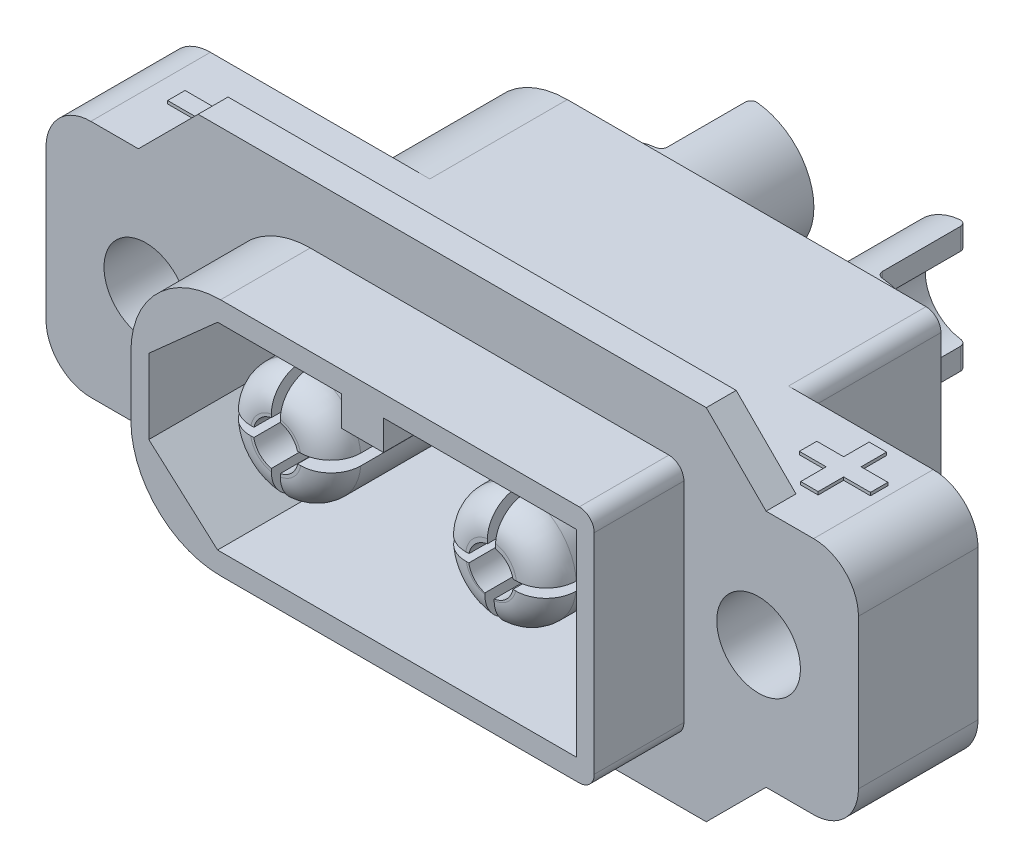
from build123d import *

# Parameters (mm, degrees)
BOSS_EXTRUDE1_DEPTH       = 3
BOSS_EXTRUDE1_DEPTH_BACK  = 8.6
SKETCH1_W                 = 15.5
SKETCH1_H                 = 8
FILLET1_R                 = 3
FILLET2_R                 = 0.5
SKETCH2_W                 = 27.18
SKETCH2_H                 = 8
BOSS_EXTRUDE2_DEPTH       = 4
FILLET3_R                 = 1.5
CUT_EXTRUDE1_DEPTH        = 1
BOSS_EXTRUDE3_DEPTH       = 1
SKETCH5_R                 = 1.4
CUT_EXTRUDE2_DEPTH        = 18.165316775
CUT_EXTRUDE3_DEPTH        = 2
CUT_EXTRUDE4_DEPTH        = 8.8
SKETCH8_R                 = 2.1
BOSS_EXTRUDE4_DEPTH       = 6
F_2_5MM_DOWEL_HOLE1_D     = 2.75
F_2_5MM_DOWEL_HOLE1_DEPTH = 6
F_2_5MM_DOWEL_HOLE1_TIP   = 0.826183351
SKETCH11_W                = 3.440433193
SKETCH11_H                = 4.792031948
SKETCH11_W_2              = 3.391284148
SKETCH11_H_2              = 4.542096385
CUT_EXTRUDE5_DEPTH        = 4.4
FILLET4_R                 = 0.2
SKETCH12_R                = 1.85
BOSS_EXTRUDE5_DEPTH       = 8.1
FILLET5_R                 = 1
CUT_EXTRUDE6_REACH        = 23.76
SKETCH15_W                = 1.211538462
SKETCH15_H                = 0.583333334
BOSS_EXTRUDE6_DEPTH       = 0.1


with BuildPart() as part:
    # Sketch1 → Boss-Extrude1 (new, two sides: drawn at the far end of the back side and taken through both)
    with BuildSketch(Plane.XY.offset(-BOSS_EXTRUDE1_DEPTH_BACK)):
        Rectangle(SKETCH1_W, SKETCH1_H)
    extrude(amount=BOSS_EXTRUDE1_DEPTH + BOSS_EXTRUDE1_DEPTH_BACK)

    # Fillet1
    fillet1_edges = [part.edges().sort_by_distance(p)[0] for p in [
        (-7.75, 4, -2.8),
        (-7.75, -4, -2.8),
    ]]
    fillet(fillet1_edges, radius=FILLET1_R)

    # Fillet2
    fillet2_edges = [part.edges().sort_by_distance(p)[0] for p in [
        (7.75, 4, -2.8),
        (7.75, -4, -2.8),
    ]]
    fillet(fillet2_edges, radius=FILLET2_R)

    # Sketch2 → Boss-Extrude2 (add)
    with BuildSketch(Plane.XY):
        Rectangle(SKETCH2_W, SKETCH2_H)
    extrude(amount=-BOSS_EXTRUDE2_DEPTH)

    # Fillet3
    fillet3_edges = [part.edges().sort_by_distance(p)[0] for p in [
        (13.59, -4, -2),
        (-13.59, 4, -2),
        (-13.59, -4, -2),
        (13.59, 4, -2),
    ]]
    fillet(fillet3_edges, radius=FILLET3_R)

    # Sketch3 → Cut-Extrude1 (cut)
    with BuildSketch(Plane(origin=(0, 0, -8.6), x_dir=(-1, 0, 0), z_dir=(0, 0, -1))):
        with BuildLine():
            Line((-7.05, 3.3), (-7.05, -3.3))
            Line((-7.05, -3.3), (4.75, -3.3))
            ThreePointArc((4.75, -3.3), (6.376345597, -2.626345597), (7.05, -1))
            Line((7.05, -1), (7.05, 1))
            ThreePointArc((7.05, 1), (6.376345597, 2.626345597), (4.75, 3.3))
            Line((4.75, 3.3), (-7.05, 3.3))
        make_face()
    extrude(amount=-CUT_EXTRUDE1_DEPTH, mode=Mode.SUBTRACT)

    # Sketch4 → Boss-Extrude3 (add)
    with BuildSketch(Plane.XY):
        Polygon((8.5, 6), (10.5, 4), (10.5, -4), (8.5, -6), (-8.5, -6), (-10.5, -4), (-10.5, 4), (-8.5, 6), align=None)
    extrude(amount=-BOSS_EXTRUDE3_DEPTH)

    # Sketch5 → Cut-Extrude2 (cut, through all)
    with BuildSketch(Plane.XY):
        with Locations((10.25, 0)):
            Circle(SKETCH5_R)
        with Locations((-10.25, 0)):
            Circle(SKETCH5_R)
    extrude(amount=-CUT_EXTRUDE2_DEPTH, mode=Mode.SUBTRACT)

    # Sketch6 → Cut-Extrude3 (cut)
    with BuildSketch(Plane(origin=(0, 0, -4), x_dir=(-1, 0, 0), z_dir=(0, 0, -1))):
        Polygon((-10.25, 2.817469314), (-12.69, 1.408734657), (-12.69, -1.408734657), (-10.25, -2.817469314), (-7.81, -1.408734657), (-7.81, 1.408734657), align=None)
        Polygon((10.25, 2.817469314), (7.81, 1.408734657), (7.81, -1.408734657), (10.25, -2.817469314), (12.69, -1.408734657), (12.69, 1.408734657), align=None)
    extrude(amount=-CUT_EXTRUDE3_DEPTH, mode=Mode.SUBTRACT)

    # Sketch7 → Cut-Extrude4 (cut)
    with BuildSketch(Plane.XY.offset(3)):
        Polygon((7.15, 3.3), (7.15, -3.3), (-4.85, -3.3), (-7.15, -1.25), (-7.15, 1.25), (-4.85, 3.3), (-0.7, 3.3), (-0.7, 2.3), (0.7, 2.3), (0.7, 3.3), align=None)
    extrude(amount=-CUT_EXTRUDE4_DEPTH, mode=Mode.SUBTRACT)

    # Sketch8 → Boss-Extrude4 (add)
    with BuildSketch(Plane(origin=(0, 0, -7.6), x_dir=(-1, 0, 0), z_dir=(0, 0, -1))):
        with Locations((-3.6, 0)):
            Circle(SKETCH8_R)
        with Locations((3.6, 0)):
            Circle(SKETCH8_R)
    extrude(amount=BOSS_EXTRUDE4_DEPTH)

    # Ø2.5mm Dowel Hole1
    with Locations(Plane(origin=(0, 0, -13.6), x_dir=(-1, 0, 0), z_dir=(0, 0, -1))):
        with Locations((-3.6, 0), (3.6, 0)):
            Hole(F_2_5MM_DOWEL_HOLE1_D / 2, depth=F_2_5MM_DOWEL_HOLE1_DEPTH)
            with Locations((0, 0, -(F_2_5MM_DOWEL_HOLE1_DEPTH + F_2_5MM_DOWEL_HOLE1_TIP / 2))):  # 118° drill point
                Cone(0, F_2_5MM_DOWEL_HOLE1_D / 2, F_2_5MM_DOWEL_HOLE1_TIP, mode=Mode.SUBTRACT)

    # Sketch11 → Cut-Extrude5 (cut, symmetric)
    with BuildSketch(Plane(origin=(0, 0, 0), x_dir=(1, 0, 0), z_dir=(0, 1, 0))):
        with Locations((-5.320216596, 12.996015974)):
            Rectangle(SKETCH11_W, SKETCH11_H)
        with Locations((5.295642074, 12.871048193)):
            Rectangle(SKETCH11_W_2, SKETCH11_H_2)
    extrude(amount=CUT_EXTRUDE5_DEPTH, both=True, mode=Mode.SUBTRACT)

    # Fillet4
    fillet4_edges = [part.edges().sort_by_distance(p)[0] for p in [
        (-3.6, 1.7375, -10.6),
        (-3.6, -1.7375, -10.6),
        (-3.6, 1.7375, -13.6),
        (-3.6, -1.7375, -13.6),
        (3.6, 1.7375, -10.6),
        (3.6, -1.7375, -10.6),
        (3.6, -1.7375, -13.6),
        (3.6, 1.7375, -13.6),
    ]]
    fillet(fillet4_edges, radius=FILLET4_R)

    # Sketch12 → Boss-Extrude5 (add)
    with BuildSketch(Plane.XY.offset(-5.8)):
        with Locations(Location((-3.6, 0, 0), (0, 0, 180))):
            Circle(SKETCH12_R)
        with Locations(Location((3.6, 0, 0), (0, 0, 180))):
            Circle(SKETCH12_R)
    extrude(amount=BOSS_EXTRUDE5_DEPTH)

    # Fillet5
    fillet5_edges = [part.edges().sort_by_distance(p)[0] for p in [
        (-1.75, 0, 2.3),
        (5.45, 0, 2.3),
    ]]
    fillet(fillet5_edges, radius=FILLET5_R)

    # Cut-Extrude6: up to this face of the body (flat: up to its plane)
    cut_extrude6_end = Plane(part.part.faces().sort_by_distance((0.450824697, -0.058717093, -5.8))[0])
    # Sketch14 → Cut-Extrude6 (cut, up to the picked face)
    with BuildSketch(Plane.XY.offset(2.3), mode=Mode.PRIVATE) as cut_extrude6_sk1:
        with BuildLine():
            Line((-3.75, 0.734846923), (-3.75, 2.518888588))
            Line((-3.75, 2.518888588), (-3.45, 2.518888588))
            Line((-3.45, 2.518888588), (-3.45, 0.734846923))
            ThreePointArc((-3.45, 0.734846923), (-3.088291525, 0.548319648), (-2.877253172, 0.200342265))
            Line((-2.877253172, 0.200342265), (-0.812059785, 0.200342265))
            Line((-0.812059785, 0.200342265), (-0.812059785, -0.16487495))
            Line((-0.812059785, -0.16487495), (-2.868346905, -0.16487495))
            ThreePointArc((-2.868346905, -0.16487495), (-3.075076142, -0.535681755), (-3.45, -0.734846923))
            Line((-3.45, -0.734846923), (-3.45, -2.518888588))
            Line((-3.45, -2.518888588), (-3.75, -2.518888588))
            Line((-3.75, -2.518888588), (-3.75, -0.734846923))
            ThreePointArc((-3.75, -0.734846923), (-4.135554442, -0.52505375), (-4.337672773, -0.135421123))
            Line((-4.337672773, -0.135421123), (-5.890094849, -0.16456694))
            Line((-5.890094849, -0.16456694), (-5.890094849, 0.13543306))
            Line((-5.890094849, 0.13543306), (-4.331732975, 0.164520069))
            ThreePointArc((-4.331732975, 0.164520069), (-4.12505375, 0.535554442), (-3.75, 0.734846923))
        make_face()
    cut_extrude6_tool1 = split(extrude(cut_extrude6_sk1.sketch, amount=-CUT_EXTRUDE6_REACH, mode=Mode.PRIVATE), bisect_by=cut_extrude6_end, keep=Keep.BOTH, mode=Mode.PRIVATE)
    # Sketch14 → Cut-Extrude6 (cut, up to the picked face)
    with BuildSketch(Plane.XY.offset(2.3), mode=Mode.PRIVATE) as cut_extrude6_sk2:
        with BuildLine():
            Line((3.392079477, -2.61864316), (3.703960261, -2.61864316))
            Line((3.703960261, -2.61864316), (3.703960261, -0.792072113))
            ThreePointArc((3.703960261, -0.792072113), (4.111188681, -0.594965873), (4.33096163, -0.199509546))
            Line((4.33096163, -0.199509546), (6.020422905, -0.199509546))
            Line((6.020422905, -0.199509546), (6.020422905, 0.1))
            Line((6.020422905, 0.1), (4.3309117, 0.1))
            ThreePointArc((4.3309117, 0.1), (4.126414102, 0.480408518), (3.746039739, 0.684969637))
            Line((3.746039739, 0.684969637), (3.8, 2.518888588))
            Line((3.8, 2.518888588), (3.5, 2.518888588))
            Line((3.5, 2.518888588), (3.475216106, 0.690326503))
            ThreePointArc((3.475216106, 0.690326503), (3.076256051, 0.490793517), (2.861167778, 0.1))
            Line((2.861167778, 0.1), (1.179577095, 0.1))
            Line((1.179577095, 0.1), (1.179577095, -0.2))
            Line((1.179577095, -0.2), (2.855835949, -0.170700918))
            ThreePointArc((2.855835949, -0.170700918), (3.036455243, -0.549242075), (3.392079477, -0.771611456))
            Line((3.392079477, -0.771611456), (3.392079477, -2.61864316))
        make_face()
    cut_extrude6_tool2 = split(extrude(cut_extrude6_sk2.sketch, amount=-CUT_EXTRUDE6_REACH, mode=Mode.PRIVATE), bisect_by=cut_extrude6_end, keep=Keep.BOTH, mode=Mode.PRIVATE)
    add(cut_extrude6_tool1.solids().sort_by(Axis((-3.447746, 0.003301, 2.3), (0, 0, -1)))[0], mode=Mode.SUBTRACT)
    add(cut_extrude6_tool2.solids().sort_by(Axis((3.603073, -0.067799, 2.3), (0, 0, -1)))[0], mode=Mode.SUBTRACT)

    # Sketch15 → Boss-Extrude6 (add)
    with BuildSketch(Plane(origin=(0, 4, 0), x_dir=(1, 0, 0), z_dir=(0, 1, 0))):
        with Locations((-10.701923077, 2.078846154)):
            Rectangle(SKETCH15_W, SKETCH15_H)
        Polygon((10.320512821, 2.774358974), (10.320512821, 3.626923077), (10.903846154, 3.626923077), (10.903846154, 2.774358974), (11.801282051, 2.774358974), (11.801282051, 2.191025641), (10.903846154, 2.191025641), (10.903846154, 1.338461538), (10.320512821, 1.338461538), (10.320512821, 2.191025641), (9.423076923, 2.191025641), (9.423076923, 2.774358974), align=None)
    extrude(amount=BOSS_EXTRUDE6_DEPTH)


solid = part.part
